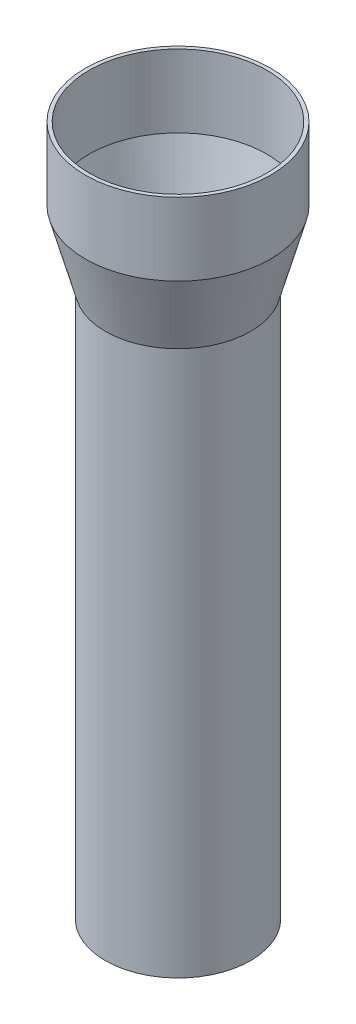
from build123d import *

# Parameters (mm, degrees)
SKETCH1_R           = 10
BOSS_EXTRUDE1_DEPTH = 75
SKETCH2_R           = 9.5
CUT_EXTRUDE1_DEPTH  = 77.321687612
SKETCH4_W           = 0.5
SKETCH4_H           = 10


with BuildPart() as part:
    # Sketch1 → Boss-Extrude1 (new body)
    with BuildSketch(Plane(origin=(0, 0, 0), x_dir=(1, 0, 0), z_dir=(0, 1, 0))):
        with Locations(Location((0, 0, 0), (0, 0, 270))):
            Circle(SKETCH1_R)
    extrude(amount=BOSS_EXTRUDE1_DEPTH)

    # Sketch2 → Cut-Extrude1 (cut, through all)
    with BuildSketch(Plane(origin=(0, 75, 0), x_dir=(1, 0, 0), z_dir=(0, 1, 0))):
        with Locations(Location((0, 0, 0), (0, 0, 270))):
            Circle(SKETCH2_R)
    extrude(amount=-CUT_EXTRUDE1_DEPTH, mode=Mode.SUBTRACT)

    # Sketch3 → Revolve1 (revolve)
    with BuildSketch(Plane(origin=(0, 0, 0), x_dir=(0, 0, -1), z_dir=(1, 0, 0)), mode=Mode.PRIVATE) as revolve1_sk:
        Polygon((10, 75), (12.75, 85), (12.25, 85), (9.5, 75), align=None)
    revolve(revolve1_sk.sketch.rotate(Axis((0, 75, 0), (0, -1, 0)), 180), axis=Axis((0, 75, 0), (0, -1, 0)))

    # Sketch4 → Revolve2 (revolve)
    with BuildSketch(Plane(origin=(0, 0, 0), x_dir=(0, 0, -1), z_dir=(1, 0, 0)), mode=Mode.PRIVATE) as revolve2_sk:
        with Locations((12.5, 90)):
            Rectangle(SKETCH4_W, SKETCH4_H)
    revolve(revolve2_sk.sketch.rotate(Axis((0, 75, 0), (0, -1, 0)), 180), axis=Axis((0, 75, 0), (0, -1, 0)))


solid = part.part
